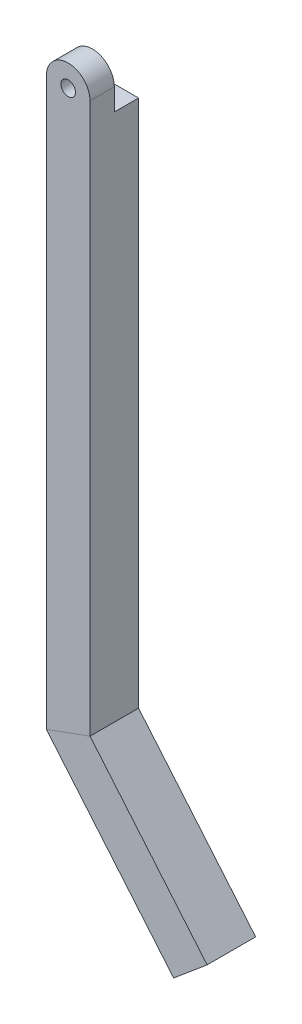
from build123d import *

# Parameters (mm, degrees)
SKETCH_4_W          = 9
SKETCH_4_H          = 10
EXTRUDE_2_DEPTH     = 10
CUT_EXTRUDE_1_DEPTH = 10
SKETCH_4_2_W        = 9
SKETCH_4_2_H        = 10
CUT_EXTRUDE_2_DEPTH = 10
SKETCH_8_R          = 1.5
CUT_EXTRUDE_3_DEPTH = 10


with BuildPart() as part:
    # 草图4 → 凸台-拉伸2 (new body)
    with BuildSketch(Plane(origin=(0, 0, 0), x_dir=(1, 0, 0), z_dir=(0, 1, 0))):
        with Locations((-19.8, -3.957142857)):
            Rectangle(SKETCH_4_W, SKETCH_4_H)
    extrude(amount=EXTRUDE_2_DEPTH)

    # 草图6 → 切除-拉伸1 (cut)
    with BuildSketch(Plane.XY.offset(8.957142857)):
        with BuildLine():
            Line((-24.3, 10), (-24.3, 5))
            ThreePointArc((-24.3, 5), (-19.8, 9.5), (-15.3, 5))
            Line((-15.3, 5), (-15.3, 10))
            Line((-15.3, 10), (-24.3, 10))
        make_face()
    extrude(amount=-CUT_EXTRUDE_1_DEPTH, mode=Mode.SUBTRACT)

    # 扫描2: sweep along a path in 草图5
    with BuildLine(Plane.XY.offset(3.957142857)) as sweep_2_path:
        Line((-19.8, 0), (-19.8, -110))
        Line((-19.8, -110), (5.372988935, -140))
    # 草图4<2> → 扫描2 (sweep)
    with BuildSketch(Plane(origin=(0, 0, 0), x_dir=(1, 0, 0), z_dir=(0, 1, 0))):
        with Locations((-19.8, -3.957142857)):
            Rectangle(SKETCH_4_2_W, SKETCH_4_2_H)
    sweep(path=sweep_2_path.line, transition=Transition.RIGHT)

    # 草图7 → 切除-拉伸2 (cut)
    with BuildSketch(Plane.XY.offset(3.957142857)):
        with BuildLine():
            Line((-24.3, 5), (-24.3, 0.5))
            Line((-24.3, 0.5), (-15.3, 0.5))
            Line((-15.3, 0.5), (-15.3, 5))
            ThreePointArc((-15.3, 5), (-19.8, 9.5), (-24.3, 5))
        make_face()
    extrude(amount=-CUT_EXTRUDE_2_DEPTH, mode=Mode.SUBTRACT)

    # 草图8 → 切除-拉伸3 (cut)
    with BuildSketch(Plane(origin=(0, 0, 3.957142857), x_dir=(-1, 0, 0), z_dir=(0, 0, -1))):
        with Locations((19.8, 5)):
            Circle(SKETCH_8_R)
    extrude(amount=-CUT_EXTRUDE_3_DEPTH, mode=Mode.SUBTRACT)


solid = part.part
